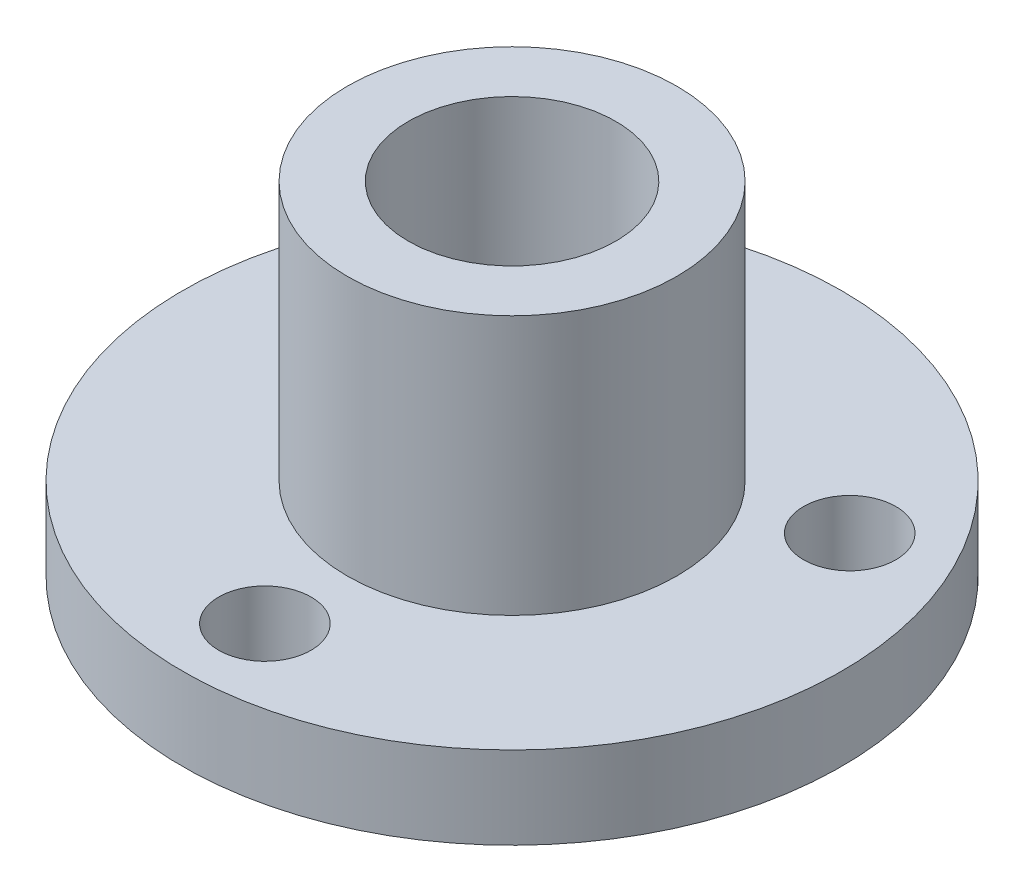
from build123d import *

# Parameters (mm, degrees)
SKETCH1_R           = 12.7
BOSS_EXTRUDE1_DEPTH = 3.18
SKETCH2_R           = 6.35
BOSS_EXTRUDE2_DEPTH = 10
SKETCH3_R           = 4
CUT_EXTRUDE1_DEPTH  = 23.277621058
SKETCH4_R           = 1.78
CUT_EXTRUDE2_DEPTH  = 21.556750716


with BuildPart() as part:
    # Sketch1 → Boss-Extrude1 (new body)
    with BuildSketch(Plane(origin=(0, 0, 0), x_dir=(1, 0, 0), z_dir=(0, 1, 0))):
        with Locations(Location((0, 0, 0), (0, 0, 90))):
            Circle(SKETCH1_R)
    extrude(amount=BOSS_EXTRUDE1_DEPTH)

    # Sketch2 → Boss-Extrude2 (add)
    with BuildSketch(Plane(origin=(0, 3.18, 0), x_dir=(1, 0, 0), z_dir=(0, 1, 0))):
        with Locations(Location((0, 0, 0), (0, 0, 270))):
            Circle(SKETCH2_R)
    extrude(amount=BOSS_EXTRUDE2_DEPTH)

    # Sketch3 → Cut-Extrude1 (cut, through all)
    with BuildSketch(Plane(origin=(0, 13.18, 0), x_dir=(1, 0, 0), z_dir=(0, 1, 0))):
        with Locations(Location((0, 0, 0), (0, 0, 270))):
            Circle(SKETCH3_R)
    extrude(amount=-CUT_EXTRUDE1_DEPTH, mode=Mode.SUBTRACT)

    # Sketch4 → Cut-Extrude2 (cut, through all)
    with BuildSketch(Plane(origin=(0, 3.18, 0), x_dir=(1, 0, 0), z_dir=(0, 1, 0))):
        with Locations(Location((0, -9.525, 0), (0, 0, 270))):
            Circle(SKETCH4_R)
        with Locations(Location((-8.248891971, 4.7625, 0), (0, 0, 270))):
            Circle(SKETCH4_R)
        with Locations(Location((8.248891971, 4.7625, 0), (0, 0, 270))):
            Circle(SKETCH4_R)
    extrude(amount=-CUT_EXTRUDE2_DEPTH, mode=Mode.SUBTRACT)


solid = part.part
